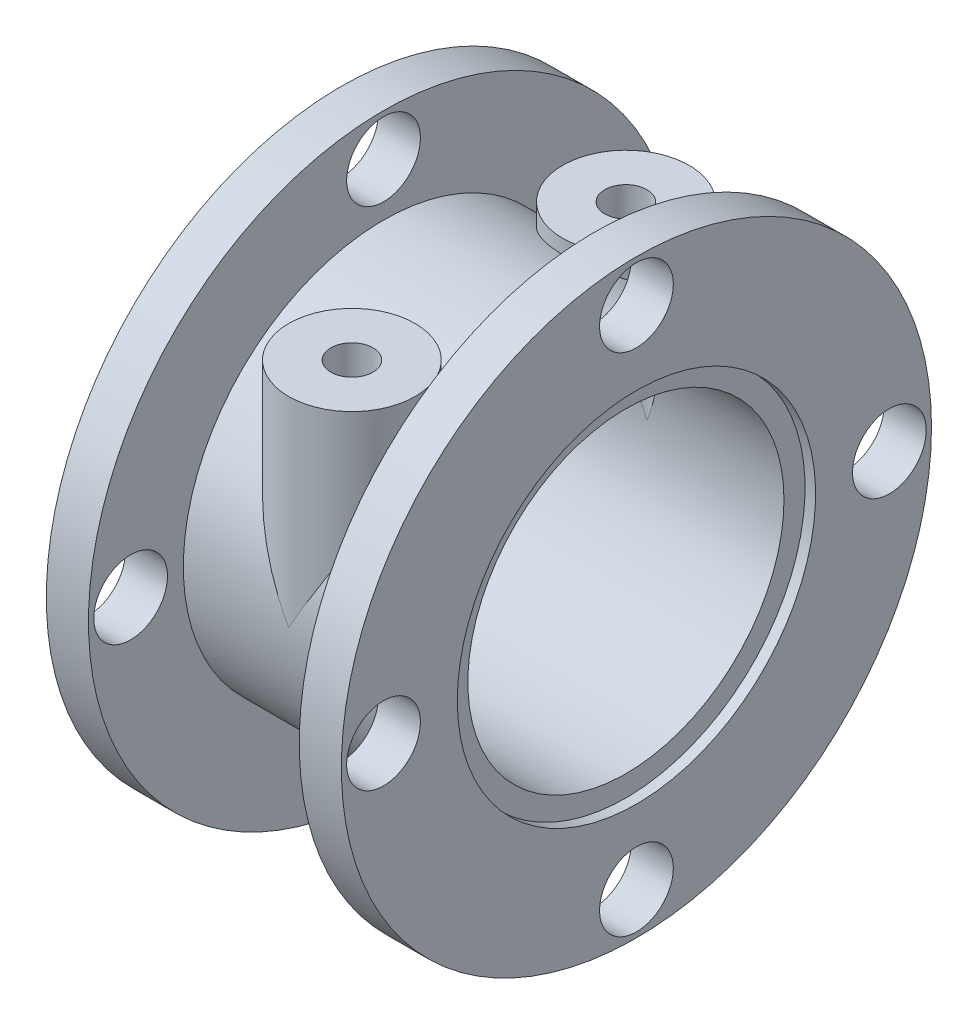
from build123d import *

# Parameters (mm, degrees)
SKETCH2_R                = 14
SKETCH2_R_2              = 1.75
SKETCH2_R_3              = 7.5
FLANGE_DEPTH             = 2
SKETCH3_R                = 8.5
O_RING_SEAT_DEPTH        = 0.5
BOSS_EXTRUDE1_START      = 10
SKETCH4_R                = 9.5
SKETCH4_R_2              = 7.5
BOSS_EXTRUDE1_DEPTH      = 10
SKETCH5_R                = 1
OUTLET_DEPTH             = 24.151673806
BOSS_EXTRUDE2_REACH      = 31.871
BOSS_EXTRUDE2_END_RADIUS = 9.5
SKETCH6_R                = 3
SKETCH6_R_2              = 1


with BuildPart() as part:
    # Sketch2 → Flange (new body)
    with BuildSketch(Plane(origin=(0, 0, 0), x_dir=(0, 0, -1), z_dir=(1, 0, 0))):
        Circle(SKETCH2_R)
        with Locations((0, 12)):
            Circle(SKETCH2_R_2, mode=Mode.SUBTRACT)
        with Locations((12, 0)):
            Circle(SKETCH2_R_2, mode=Mode.SUBTRACT)
        with Locations((0, -12)):
            Circle(SKETCH2_R_2, mode=Mode.SUBTRACT)
        with Locations((-12, 0)):
            Circle(SKETCH2_R_2, mode=Mode.SUBTRACT)
        Circle(SKETCH2_R_3, mode=Mode.SUBTRACT)
    flange = extrude(amount=-FLANGE_DEPTH)

    # Sketch3 → O-Ring Seat (cut)
    with BuildSketch(Plane.ZY.offset(2)):
        Circle(SKETCH3_R)
    o_ring_seat = extrude(amount=-O_RING_SEAT_DEPTH, mode=Mode.SUBTRACT)

    # Sketch4 → Boss-Extrude1 (add)
    with BuildSketch(Plane(origin=(0, 0, 0), x_dir=(0, 0, -1), z_dir=(1, 0, 0)).offset(BOSS_EXTRUDE1_START)):
        Circle(SKETCH4_R)
        Circle(SKETCH4_R_2, mode=Mode.SUBTRACT)
    extrude(amount=-BOSS_EXTRUDE1_DEPTH)

    # Mirror1: Flange, O-Ring Seat across plane
    add(flange.mirror(Plane(origin=(5, 0, 0), x_dir=(0, 0, 1), z_dir=(1, 0, 0))))
    add(o_ring_seat.mirror(Plane(origin=(5, 0, 0), x_dir=(0, 0, 1), z_dir=(1, 0, 0))), mode=Mode.SUBTRACT)

    # Sketch5 → Outlet (cut, through all)
    with BuildSketch(Plane(origin=(0, 0, 0), x_dir=(1, 0, 0), z_dir=(0, 1, 0))):
        with Locations(Location((5, 6.5, 0), (0, 0, 90))):
            Circle(SKETCH5_R)
    outlet = extrude(amount=OUTLET_DEPTH, mode=Mode.SUBTRACT)

    # Boss-Extrude2: up to this cylinder (the profile starts outside it)
    boss_extrude2_end = Plane(origin=(5, 0, 0), z_dir=(-1, 0, 0)) * Cylinder(BOSS_EXTRUDE2_END_RADIUS, 83.742, mode=Mode.PRIVATE)
    # Sketch6 → Boss-Extrude2 (add, up to the surface)
    with BuildSketch(Plane(origin=(0, 9.5, 0), x_dir=(1, 0, 0), z_dir=(0, 1, 0)), mode=Mode.PRIVATE) as boss_extrude2_sk1:
        with Locations(Location((5, 6.5, 0), (0, 0, 270))):
            Circle(SKETCH6_R)
        with Locations(Location((5, 6.5, 0), (0, 0, 90))):
            Circle(SKETCH6_R_2, mode=Mode.SUBTRACT)
    boss_extrude2_tool1 = extrude(boss_extrude2_sk1.sketch, amount=-BOSS_EXTRUDE2_REACH, mode=Mode.PRIVATE) - boss_extrude2_end
    boss_extrude2 = boss_extrude2_tool1.solids().sort_by_distance((5, 9.5, -9.415147))[0]
    add(boss_extrude2)

    # Inlet: Outlet, Boss-Extrude2 across plane
    add(outlet.mirror(Plane.XY), mode=Mode.SUBTRACT)
    add(boss_extrude2.mirror(Plane.XY))


solid = part.part
